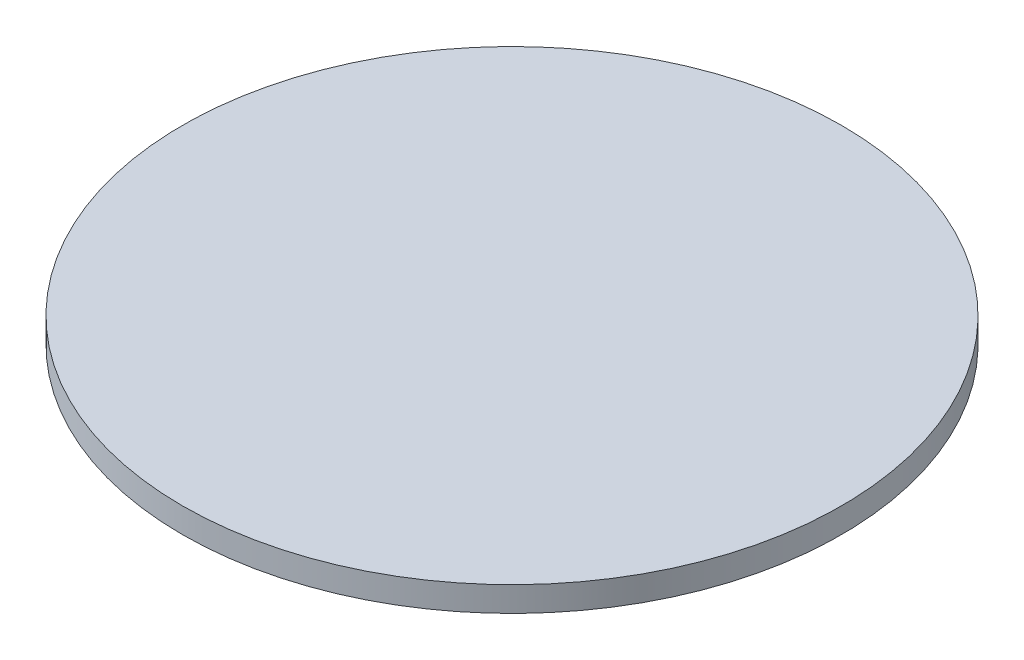
from build123d import *

# Parameters (mm, degrees)
CROQUIS1_R                               = 220.29375
SALIENTE_EXTRUIR1_DEPTH                  = 0.79375
SALIENTE_EXTRUIR2_START                  = 15.875
CROQUIS2_R                               = 220.29375
CROQUIS2_R_2                             = 219.5
SALIENTE_EXTRUIR2_DEPTH                  = 15.875
SALIENTE_EXTRUIR3_REACH                  = 313.947
SALIENTE_EXTRUIR3_END_RADIUS             = 219.5
SALIENTE_EXTRUIR3_DIRECTION_2_REACH      = 313.947
SALIENTE_EXTRUIR3_DIRECTION_2_END_RADIUS = 219.5
SALIENTE_EXTRUIR4_REACH                  = 496.478
SALIENTE_EXTRUIR4_END_RADIUS             = 220.29375
CROQUIS4_W                               = 27.396001645
CROQUIS4_H                               = 13.46587221


with BuildPart() as part:
    # Croquis1 → Saliente-Extruir1 (new body)
    with BuildSketch(Plane(origin=(0, 0, 0), x_dir=(1, 0, 0), z_dir=(0, 1, 0))):
        with Locations(Location((0, 0, 0), (0, 0, 270))):
            Circle(CROQUIS1_R)
    extrude(amount=SALIENTE_EXTRUIR1_DEPTH)

    # Croquis2 → Saliente-Extruir2 (add)
    with BuildSketch(Plane.XZ.offset(SALIENTE_EXTRUIR2_START)):
        with Locations(Location((0, 0, 0), (0, 0, 270))):
            Circle(CROQUIS2_R)
        with Locations(Location((0, 0, 0), (0, 0, 270))):
            Circle(CROQUIS2_R_2, mode=Mode.SUBTRACT)
    extrude(amount=-SALIENTE_EXTRUIR2_DEPTH)

    # Saliente-Extruir3: up to this cylinder (the profile starts inside it)
    saliente_extruir3_end = Plane(origin=(0, -2.525568, 0), z_dir=(0, 1, 0)) * Cylinder(SALIENTE_EXTRUIR3_END_RADIUS, 1067.894, mode=Mode.PRIVATE)
    # Croquis3 → Saliente-Extruir3 (add, up to the surface)
    with BuildSketch(Plane(origin=(0, 0, 0), x_dir=(0, 0, -1), z_dir=(1, 0, 0)), mode=Mode.PRIVATE) as saliente_extruir3_sk1:
        Polygon((-12.7, 0.79375), (12.7, 0.79375), (12.7, -2.38125), (1.5875, -2.38125), (1.5875, -11.90625), (-1.5875, -11.90625), (-1.5875, -2.38125), (-12.7, -2.38125), align=None)
    saliente_extruir3_tool1 = extrude(saliente_extruir3_sk1.sketch, amount=SALIENTE_EXTRUIR3_REACH, mode=Mode.PRIVATE) & saliente_extruir3_end
    add(saliente_extruir3_tool1.solids().sort_by_distance((0, -2.525568, 0))[0])

    # Saliente-Extruir3 direction 2: up to this cylinder (the profile starts inside it)
    saliente_extruir3_direction_2_end = Plane(origin=(0, -2.525568, 0), z_dir=(0, 1, 0)) * Cylinder(SALIENTE_EXTRUIR3_DIRECTION_2_END_RADIUS, 1067.894, mode=Mode.PRIVATE)
    # Croquis3 → Saliente-Extruir3 direction 2 (add, up to the surface)
    with BuildSketch(Plane(origin=(0, 0, 0), x_dir=(0, 0, -1), z_dir=(1, 0, 0)), mode=Mode.PRIVATE) as saliente_extruir3_direction_2_sk1:
        Polygon((-12.7, 0.79375), (12.7, 0.79375), (12.7, -2.38125), (1.5875, -2.38125), (1.5875, -11.90625), (-1.5875, -11.90625), (-1.5875, -2.38125), (-12.7, -2.38125), align=None)
    saliente_extruir3_direction_2_tool1 = extrude(saliente_extruir3_direction_2_sk1.sketch, amount=-SALIENTE_EXTRUIR3_DIRECTION_2_REACH, mode=Mode.PRIVATE) & saliente_extruir3_direction_2_end
    add(saliente_extruir3_direction_2_tool1.solids().sort_by_distance((0, -2.525568, 0))[0])

    # Saliente-Extruir4: up to this cylinder (the profile starts outside it)
    saliente_extruir4_end = Plane(origin=(0, -6.732936, 0), z_dir=(0, -1, 0)) * Cylinder(SALIENTE_EXTRUIR4_END_RADIUS, 1434.5435, mode=Mode.PRIVATE)
    # Croquis4 → Saliente-Extruir4 (add, up to the surface)
    with BuildSketch(Plane(origin=(-220.262941422, 0, 3.684145126), x_dir=(0.01672378415604664, 0, 0.999860147742424), z_dir=(-0.999860147742424, 0, 0.01672378415604664)), mode=Mode.PRIVATE) as saliente_extruir4_sk1:
        with Locations((1.488935582, -6.732936105)):
            Rectangle(CROQUIS4_W, CROQUIS4_H)
    saliente_extruir4_tool1 = extrude(saliente_extruir4_sk1.sketch, amount=-SALIENTE_EXTRUIR4_REACH, mode=Mode.PRIVATE) - saliente_extruir4_end
    add(saliente_extruir4_tool1.solids().sort_by_distance((-220.238041, -6.732936, 5.172872))[0])
    add(saliente_extruir4_tool1.solids().sort_by_distance((-220.238041, -6.732936, 5.172872))[1])


solid = part.part
